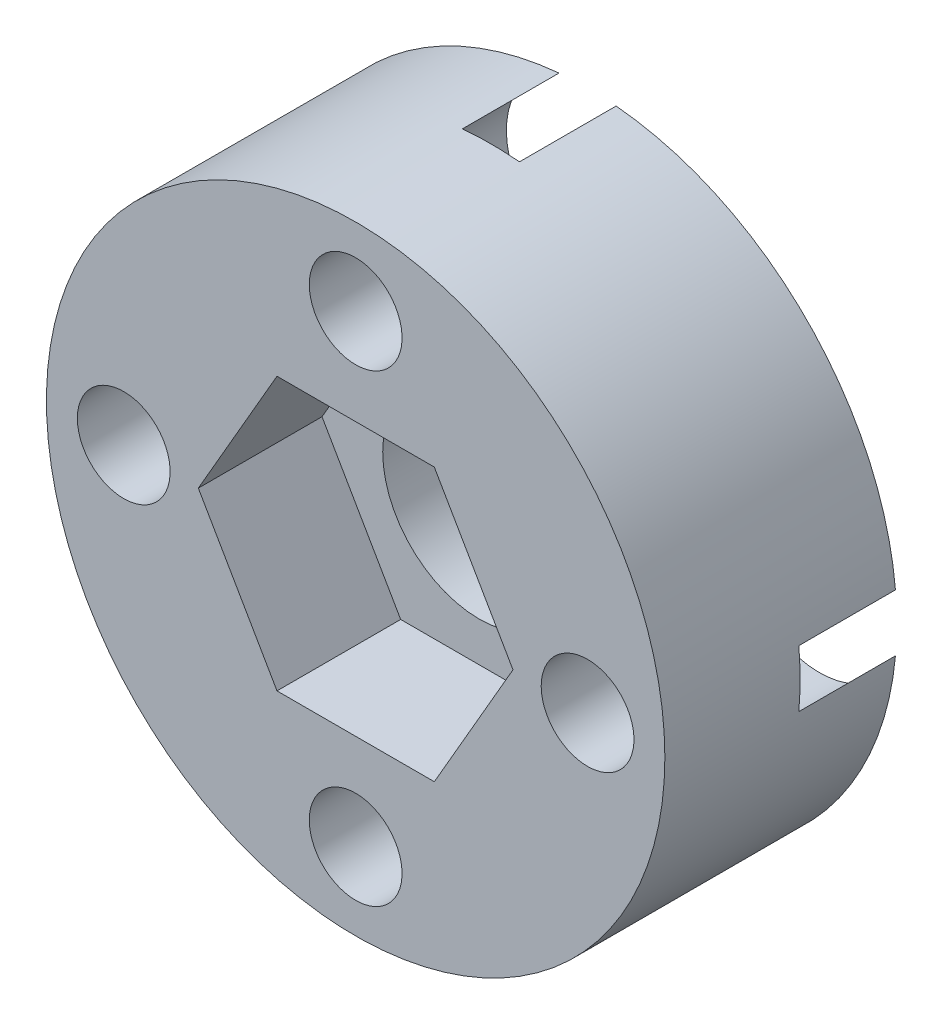
from build123d import *

# Parameters (mm, degrees)
SKETCH_1_R                   = 8
EXTRUDE_1_DEPTH              = 6
CUT_EXTRUDE_1_DEPTH          = 3.2
HOLE_WIZARD_M2_1_D           = 2.4
HOLE_WIZARD_M2_1_CBORE_D     = 4.2
HOLE_WIZARD_M2_1_CBORE_DEPTH = 2.5
PATTERN_CIRCULAR_1_COUNT     = 4
HOLE_WIZARD_M4_1_D           = 5


with BuildPart() as part:
    # ｽｹｯﾁ1 → ﾎﾞｽ - 押し出し1 (new body)
    with BuildSketch(Plane.XY):
        Circle(SKETCH_1_R)
    extrude(amount=EXTRUDE_1_DEPTH)

    # ｽｹｯﾁ2 → ｶｯﾄ - 押し出し1 (cut)
    with BuildSketch(Plane.XY.offset(6)):
        Polygon((4.070319398, 0), (2.035159699, 3.525), (-2.035159699, 3.525), (-4.070319398, 0), (-2.035159699, -3.525), (2.035159699, -3.525), align=None)
    extrude(amount=-CUT_EXTRUDE_1_DEPTH, mode=Mode.SUBTRACT)

    # M2 丸平ねじ用座ぐり穴1 (through all)
    with Locations(Plane(origin=(0, 0, 0), x_dir=(-1, 0, 0), z_dir=(0, 0, -1))):
        with Locations((6, 0)):
            hole_wizard_m2_1 = CounterBoreHole(HOLE_WIZARD_M2_1_D / 2, HOLE_WIZARD_M2_1_CBORE_D / 2, HOLE_WIZARD_M2_1_CBORE_DEPTH)

    # 円形ﾊﾟﾀｰﾝ1: M2 丸平ねじ用座ぐり穴1 ×4 about axis
    pattern_circular_1_axis = Axis((0, 0, 0), (0, 0, 1))
    for i in range(1, PATTERN_CIRCULAR_1_COUNT):
        add(hole_wizard_m2_1.rotate(pattern_circular_1_axis, i * 360 / PATTERN_CIRCULAR_1_COUNT), mode=Mode.SUBTRACT)

    # M4 すきま穴1 (through all)
    with Locations(Plane(origin=(0, 0, 0), x_dir=(-1, 0, 0), z_dir=(0, 0, -1))):
        with Locations((0, 0)):
            Hole(HOLE_WIZARD_M4_1_D / 2)


solid = part.part
